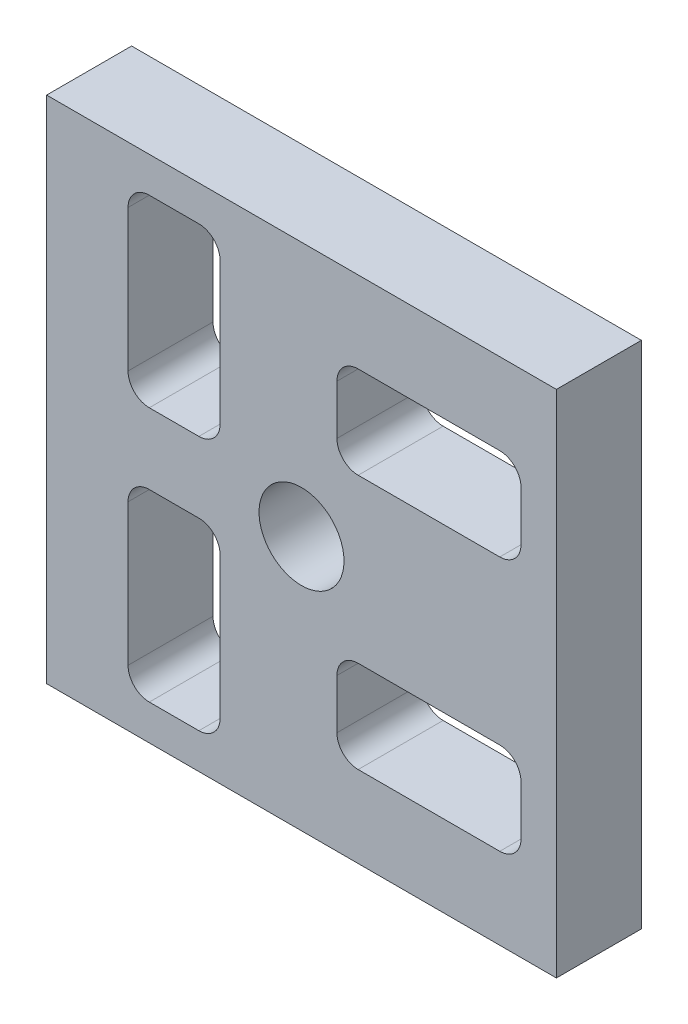
from build123d import *

# Parameters (mm, degrees)
MODEL_W                 = 18
MODEL_H                 = 18
MODEL_R                 = 1.5
SALIENTE_EXTRUIR1_DEPTH = 3


with BuildPart() as part:
    # Model → Saliente-Extruir1 (new body)
    with BuildSketch(Plane.XY):
        with Locations((199.835922194, 170.333196305)):
            Rectangle(MODEL_W, MODEL_H)
        with Locations((199.835922194, 170.333196305)):
            Circle(MODEL_R, mode=Mode.SUBTRACT)
        with BuildLine():
            Line((201.835922194, 176.458196305), (206.835922194, 176.458196305))
            ThreePointArc((206.835922194, 176.458196305), (207.36625228, 176.23852639), (207.585922194, 175.708196305))
            Line((207.585922194, 175.708196305), (207.585922194, 173.958196305))
            ThreePointArc((207.585922194, 173.958196305), (207.36625228, 173.427866219), (206.835922194, 173.208196305))
            Line((206.835922194, 173.208196305), (201.835922194, 173.208196305))
            ThreePointArc((201.835922194, 173.208196305), (201.305592108, 173.427866219), (201.085922194, 173.958196305))
            Line((201.085922194, 173.958196305), (201.085922194, 175.708196305))
            ThreePointArc((201.085922194, 175.708196305), (201.305592108, 176.23852639), (201.835922194, 176.458196305))
        make_face(mode=Mode.SUBTRACT)
        with BuildLine():
            Line((201.835922194, 167.458196305), (206.835922194, 167.458196305))
            ThreePointArc((206.835922194, 167.458196305), (207.36625228, 167.23852639), (207.585922194, 166.708196305))
            Line((207.585922194, 166.708196305), (207.585922194, 164.958196305))
            ThreePointArc((207.585922194, 164.958196305), (207.36625228, 164.427866219), (206.835922194, 164.208196305))
            Line((206.835922194, 164.208196305), (201.835922194, 164.208196305))
            ThreePointArc((201.835922194, 164.208196305), (201.305592108, 164.427866219), (201.085922194, 164.958196305))
            Line((201.085922194, 164.958196305), (201.085922194, 166.708196305))
            ThreePointArc((201.085922194, 166.708196305), (201.305592108, 167.23852639), (201.835922194, 167.458196305))
        make_face(mode=Mode.SUBTRACT)
        with BuildLine():
            Line((196.960922194, 168.333196305), (196.960922194, 163.333196305))
            ThreePointArc((196.960922194, 163.333196305), (196.74125228, 162.802866219), (196.210922194, 162.583196305))
            Line((196.210922194, 162.583196305), (194.460922194, 162.583196305))
            ThreePointArc((194.460922194, 162.583196305), (193.930592108, 162.802866219), (193.710922194, 163.333196305))
            Line((193.710922194, 163.333196305), (193.710922194, 168.333196305))
            ThreePointArc((193.710922194, 168.333196305), (193.930592108, 168.86352639), (194.460922194, 169.083196305))
            Line((194.460922194, 169.083196305), (196.210922194, 169.083196305))
            ThreePointArc((196.210922194, 169.083196305), (196.74125228, 168.86352639), (196.960922194, 168.333196305))
        make_face(mode=Mode.SUBTRACT)
        with BuildLine():
            Line((196.960922194, 177.333196305), (196.960922194, 172.333196305))
            ThreePointArc((196.960922194, 172.333196305), (196.74125228, 171.802866219), (196.210922194, 171.583196305))
            Line((196.210922194, 171.583196305), (194.460922194, 171.583196305))
            ThreePointArc((194.460922194, 171.583196305), (193.930592108, 171.802866219), (193.710922194, 172.333196305))
            Line((193.710922194, 172.333196305), (193.710922194, 177.333196305))
            ThreePointArc((193.710922194, 177.333196305), (193.930592108, 177.86352639), (194.460922194, 178.083196305))
            Line((194.460922194, 178.083196305), (196.210922194, 178.083196305))
            ThreePointArc((196.210922194, 178.083196305), (196.74125228, 177.86352639), (196.960922194, 177.333196305))
        make_face(mode=Mode.SUBTRACT)
    extrude(amount=SALIENTE_EXTRUIR1_DEPTH)


solid = part.part
